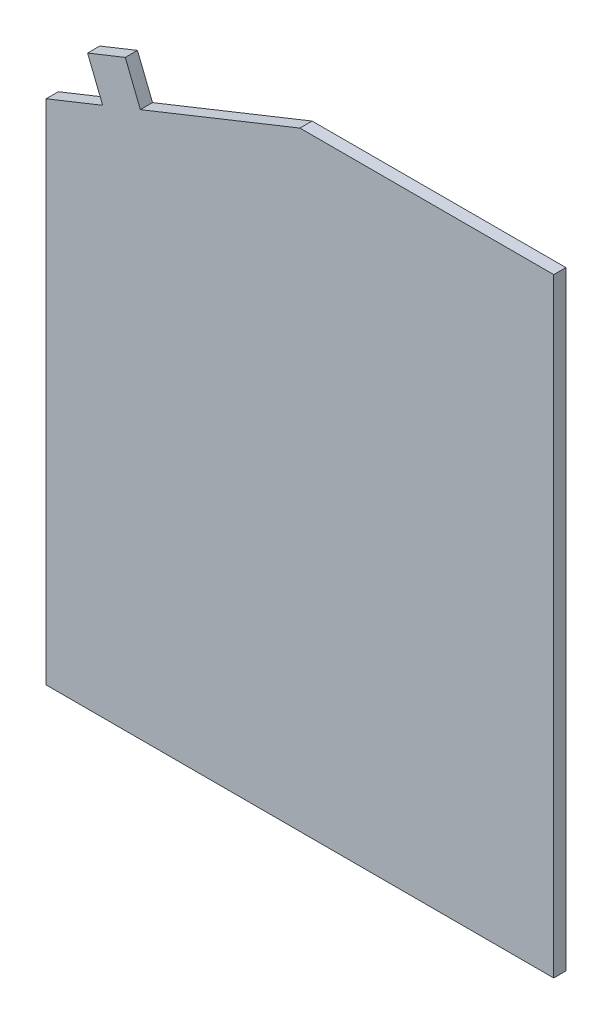
from build123d import *

# Parameters (mm, degrees)
BOSS_EXTRU_1_DEPTH = 3


with BuildPart() as part:
    # Esquisse1 → Boss.-Extru.1 (new body)
    with BuildSketch(Plane.XY):
        Polygon((0, 0), (125, 0), (125, 150), (62.5, 150), (23.211917272, 134.284766909), (19.498010509, 143.569533818), (10.2132436, 139.855627054), (13.927150363, 130.570860145), (0, 125), align=None)
    extrude(amount=BOSS_EXTRU_1_DEPTH)


solid = part.part
